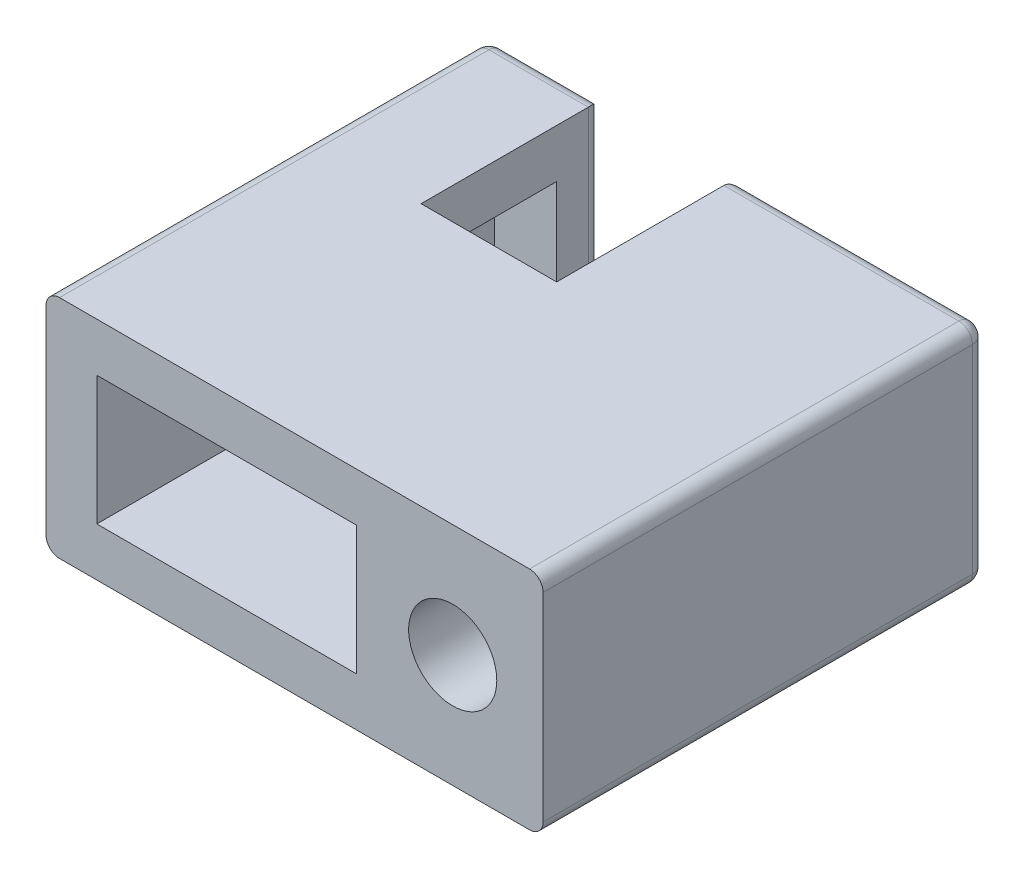
from build123d import *

# Parameters (mm, degrees)
BOSS_EXTRUDE1_DEPTH      = 4
BOSS_EXTRUDE1_DEPTH_BACK = 5.8
SKETCH1_W                = 11
SKETCH1_H                = 5
SKETCH1_R                = 0.975
SKETCH1_W_2              = 5.75
SKETCH1_H_2              = 2.85
CUT_EXTRUDE1_DEPTH       = 10.901799079
CUT_EXTRUDE1_DEPTH_BACK  = 10.901799079
SKETCH3_W                = 3
SKETCH3_H                = 4
SKETCH4_W                = 1.375
SKETCH4_H                = 2.85
BOSS_EXTRUDE3_DEPTH      = 1
FILLET1_R                = 0.3
FILLET2_R                = 0.3


with BuildPart() as part:
    # Sketch1 → Boss-Extrude1 (new, two sides: drawn at the far end of the back side and taken through both)
    with BuildSketch(Plane.XY.offset(-BOSS_EXTRUDE1_DEPTH_BACK)):
        with Locations((1.5, -1.325)):
            Rectangle(SKETCH1_W, SKETCH1_H)
        with Locations((5, -1.325)):
            Circle(SKETCH1_R, mode=Mode.SUBTRACT)
        with Locations((0, -1.325)):
            Rectangle(SKETCH1_W_2, SKETCH1_H_2, mode=Mode.SUBTRACT)
    extrude(amount=BOSS_EXTRUDE1_DEPTH + BOSS_EXTRUDE1_DEPTH_BACK)

    # Sketch3 → Cut-Extrude1 (cut, two sides: drawn at the far end of the back side and taken through both)
    with BuildSketch(Plane(origin=(0, -2.75, 0), x_dir=(1, 0, 0), z_dir=(0, 1, 0)).offset(-CUT_EXTRUDE1_DEPTH_BACK)):
        with Locations((0, 3.8)):
            Rectangle(SKETCH3_W, SKETCH3_H)
    extrude(amount=CUT_EXTRUDE1_DEPTH + CUT_EXTRUDE1_DEPTH_BACK, mode=Mode.SUBTRACT)

    # Sketch4 → Boss-Extrude3 (add)
    with BuildSketch(Plane(origin=(0, 0, -5.8), x_dir=(-1, 0, 0), z_dir=(0, 0, -1))):
        with Locations((-2.1875, -1.325)):
            Rectangle(SKETCH4_W, SKETCH4_H)
        with Locations((2.1875, -1.325)):
            Rectangle(SKETCH4_W, SKETCH4_H)
    extrude(amount=-BOSS_EXTRUDE3_DEPTH)

    # Fillet1
    fillet1_edges = [part.edges().sort_by_distance(p)[0] for p in [
        (-4, 1.175, -0.9),
        (7, 1.175, -0.9),
        (7, -3.825, -0.9),
        (-4, -3.825, -0.9),
    ]]
    fillet(fillet1_edges, radius=FILLET1_R)

    # Fillet2
    fillet2_edges = [part.edges().sort_by_distance(p)[0] for p in [
        (-2.6, 1.175, -5.8),
        (4.1, -3.825, -5.8),
        (7, -1.325, -5.8),
        (6.912132034, -3.737132034, -5.8),
        (6.912132034, 1.087132034, -5.8),
        (-4, -1.325, -5.8),
        (-3.912132034, 1.087132034, -5.8),
        (-3.912132034, -3.737132034, -5.8),
        (4.025, -1.325, -5.8),
        (4.1, 1.175, -5.8),
        (-2.6, -3.825, -5.8),
        (1.5, -1.325, -5.8),
        (-1.5, -1.325, -5.8),
    ]]
    fillet(fillet2_edges, radius=FILLET2_R)


solid = part.part
